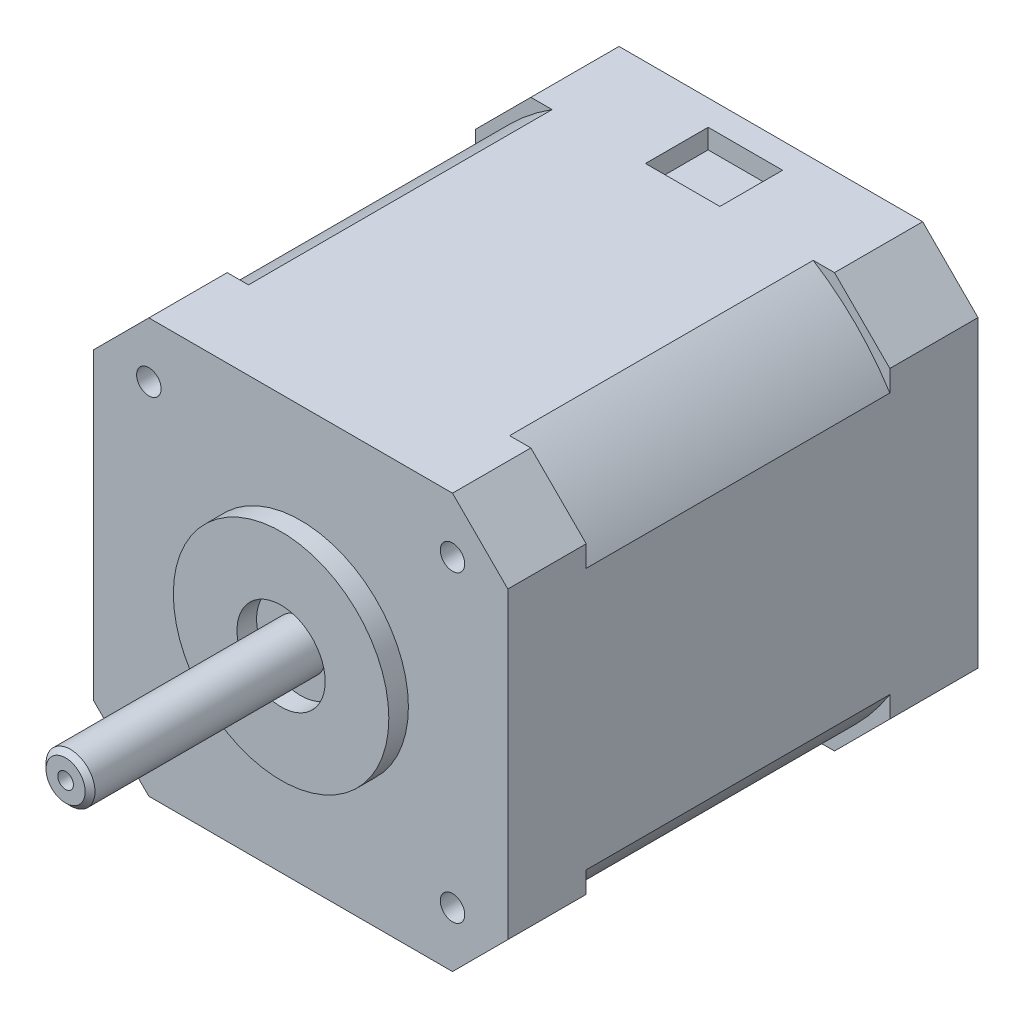
from build123d import *

# Parameters (mm, degrees)
BOSS_EXTRUDE1_DEPTH = 8
BOSS_EXTRUDE2_DEPTH = 9
BOSS_EXTRUDE3_REACH = 51.946
SKETCH5_R           = 11
SKETCH5_R_2         = 4.5
BOSS_EXTRUDE4_DEPTH = 2
SKETCH6_R           = 1.25
CUT_EXTRUDE1_DEPTH  = 57.556564606
SKETCH7_R           = 2.5
BOSS_EXTRUDE5_DEPTH = 24
CHAMFER1_SIZE       = 0.5
SKETCH8_R           = 0.8
CUT_EXTRUDE2_DEPTH  = 2.5
SKETCH9_R           = 3
CUT_EXTRUDE3_DEPTH  = 2.5
SKETCH23_W          = 7.6
SKETCH23_H          = 6.4
CUT_EXTRUDE5_DEPTH  = 2
SKETCH18_R          = 4.5
CUT_EXTRUDE4_DEPTH  = 3.5


with BuildPart() as part:
    # Sketch2 → Boss-Extrude1 (new body)
    with BuildSketch(Plane.XY):
        Polygon((-15.5, 21.15), (15.5, 21.15), (21.15, 15.5), (21.15, -15.5), (15.5, -21.15), (-15.5, -21.15), (-21.15, -15.5), (-21.15, 15.5), align=None)
    extrude(amount=-BOSS_EXTRUDE1_DEPTH)


with BuildPart() as body_2:
    # Sketch3 → Boss-Extrude2 (new body)
    with BuildSketch(Plane.XY.offset(-48)):
        Polygon((-15.5, 21.15), (15.5, 21.15), (21.15, 15.5), (21.15, -15.5), (15.5, -21.15), (-15.5, -21.15), (-21.15, -15.5), (-21.15, 15.5), align=None)
    extrude(amount=BOSS_EXTRUDE2_DEPTH)

    # Sketch4 → Boss-Extrude3 (add, up to next)
    with BuildSketch(Plane(origin=(0, 0, -8), x_dir=(-1, 0, 0), z_dir=(0, 0, -1)), mode=Mode.PRIVATE) as boss_extrude3_sk1:
        with BuildLine():
            Line((-13.329572386, 21.15), (13.329572386, 21.15))
            ThreePointArc((13.329572386, 21.15), (17.67766953, 17.67766953), (21.15, 13.329572386))
            Line((21.15, 13.329572386), (21.15, -13.329572386))
            ThreePointArc((21.15, -13.329572386), (17.67766953, -17.67766953), (13.329572386, -21.15))
            Line((13.329572386, -21.15), (-13.329572386, -21.15))
            ThreePointArc((-13.329572386, -21.15), (-17.67766953, -17.67766953), (-21.15, -13.329572386))
            Line((-21.15, -13.329572386), (-21.15, 13.329572386))
            ThreePointArc((-21.15, 13.329572386), (-17.67766953, 17.67766953), (-13.329572386, 21.15))
        make_face()
    boss_extrude3_tool1 = extrude(boss_extrude3_sk1.sketch, amount=BOSS_EXTRUDE3_REACH, mode=Mode.PRIVATE) - body_2.part

    add(part.part)  # Boss-Extrude3 merges part
    add(boss_extrude3_tool1.solids().sort_by_distance((0, 0, -8))[0])

    # Sketch5 → Boss-Extrude4 (add)
    with BuildSketch(Plane.XY):
        with Locations(Location((0, 0, 0), (0, 0, 180))):
            Circle(SKETCH5_R)
        Circle(SKETCH5_R_2, mode=Mode.SUBTRACT)
    extrude(amount=BOSS_EXTRUDE4_DEPTH)

    # Sketch6 → Cut-Extrude1 (cut, through all)
    with BuildSketch(Plane.XY):
        with Locations((-15.5, 15.5)):
            Circle(SKETCH6_R)
        with Locations((15.5, 15.5)):
            Circle(SKETCH6_R)
        with Locations((15.5, -15.5)):
            Circle(SKETCH6_R)
        with Locations((-15.5, -15.5)):
            Circle(SKETCH6_R)
    extrude(amount=-CUT_EXTRUDE1_DEPTH, mode=Mode.SUBTRACT)

    # Sketch7 → Boss-Extrude5 (add)
    with BuildSketch(Plane.XY):
        with Locations(Location((0, 0, 0), (0, 0, 180))):
            Circle(SKETCH7_R)
    extrude(amount=BOSS_EXTRUDE5_DEPTH)

    # Chamfer1
    chamfer1_edges = [body_2.edges().sort_by_distance(p)[0] for p in [
        (2.5, 0, 24),
    ]]
    chamfer(chamfer1_edges, length=CHAMFER1_SIZE)

    # Sketch8 → Cut-Extrude2 (cut)
    with BuildSketch(Plane.XY.offset(24)):
        Circle(SKETCH8_R)
    extrude(amount=-CUT_EXTRUDE2_DEPTH, mode=Mode.SUBTRACT)

    # Sketch9 → Cut-Extrude3 (cut)
    with BuildSketch(Plane(origin=(0, 0, -48), x_dir=(-1, 0, 0), z_dir=(0, 0, -1))):
        with Locations((-15.5, 15.5)):
            Circle(SKETCH9_R)
        with Locations((15.5, 15.5)):
            Circle(SKETCH9_R)
        with Locations((15.5, -15.5)):
            Circle(SKETCH9_R)
        with Locations((-15.5, -15.5)):
            Circle(SKETCH9_R)
    extrude(amount=-CUT_EXTRUDE3_DEPTH, mode=Mode.SUBTRACT)

    # Sketch23 → Cut-Extrude5 (cut)
    with BuildSketch(Plane(origin=(0, 21.15, 0), x_dir=(1, 0, 0), z_dir=(0, 1, 0))):
        with Locations((0, 42.2)):
            Rectangle(SKETCH23_W, SKETCH23_H)
    extrude(amount=-CUT_EXTRUDE5_DEPTH, mode=Mode.SUBTRACT)

    # Sketch18 → Cut-Extrude4 (cut)
    with BuildSketch(Plane(origin=(0, 0, -48), x_dir=(-1, 0, 0), z_dir=(0, 0, -1))):
        with Locations(Location((0, 0, 0), (0, 0, 180))):
            Circle(SKETCH18_R)
    extrude(amount=-CUT_EXTRUDE4_DEPTH, mode=Mode.SUBTRACT)


solid = body_2.part
